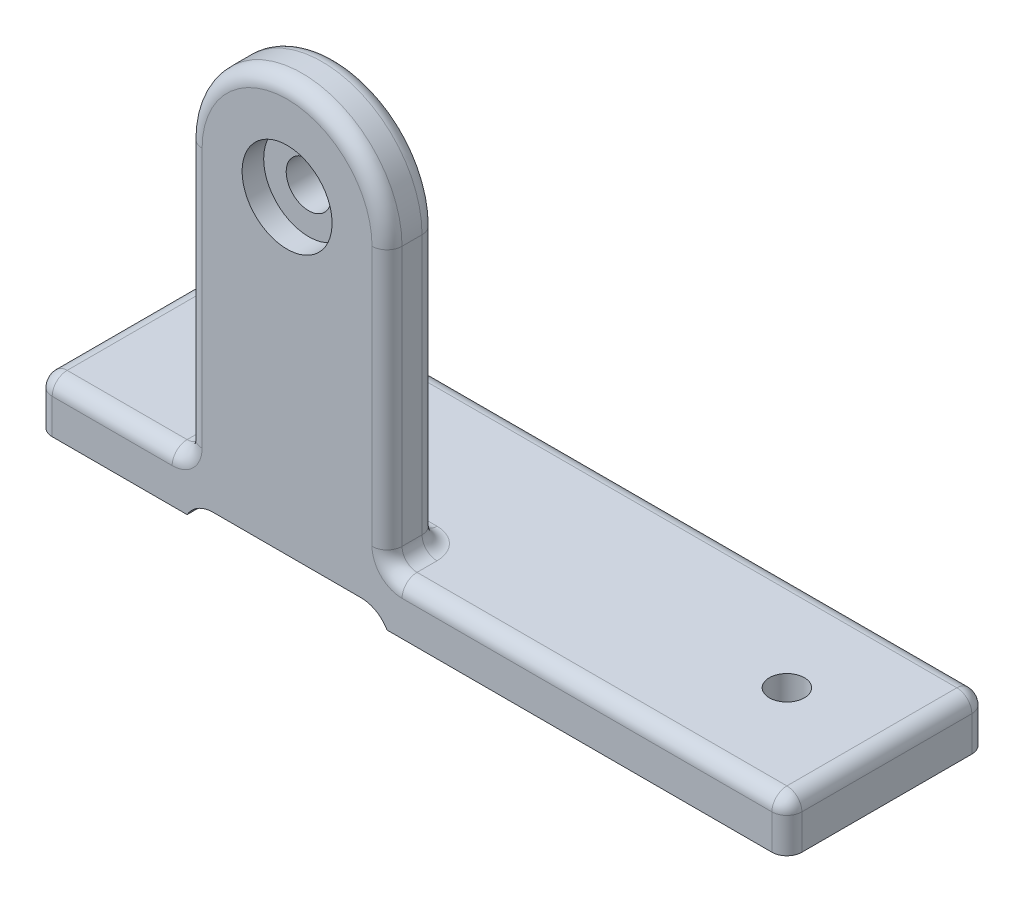
from build123d import *

# Parameters (mm, degrees)
SKETCH1_W           = 150
SKETCH1_H           = 40
BOSS_EXTRUDE1_DEPTH = 10
BOSS_EXTRUDE2_DEPTH = 10
CUT_EXTRUDE1_DEPTH  = 121.208152802
SKETCH8_R           = 3.5
CUT_EXTRUDE2_DEPTH  = 108.935165725
FILLET1_R           = 3


with BuildPart() as part:
    # Sketch1 → Boss-Extrude1 (new body)
    with BuildSketch(Plane(origin=(0, 0, 0), x_dir=(1, 0, 0), z_dir=(0, 1, 0))):
        Rectangle(SKETCH1_W, SKETCH1_H)
    extrude(amount=BOSS_EXTRUDE1_DEPTH)

    # Sketch2 → Boss-Extrude2 (add)
    with BuildSketch(Plane.XY.offset(20)):
        with BuildLine():
            Line((-45, 10), (-5, 10))
            Line((-5, 10), (-5, 65))
            ThreePointArc((-5, 65), (-25, 85), (-45, 65))
            Line((-45, 65), (-45, 10))
        make_face()
    extrude(amount=-BOSS_EXTRUDE2_DEPTH)

    # Sketch6 → CBORE for M6 SBHCS1 (revolve, cut)
    with BuildSketch(Plane(origin=(-25, 65, 10), x_dir=(0, 1, 0), z_dir=(1, 0, 0))):
        Polygon((0, 0), (0, 10), (9.005, 10), (9.005, 5.68), (4.5, 5.68), (4.5, 0), align=None)
    revolve(axis=Axis((-25, 65, 3.65), (0, 0, 1)), mode=Mode.SUBTRACT)

    # Sketch7 → Cut-Extrude1 (cut, through all)
    with BuildSketch(Plane.XY.offset(20)):
        with BuildLine():
            Line((-39.803847577, 3), (-10.196152423, 3))
            ThreePointArc((-10.196152423, 3), (-7.196152423, 2.196152423), (-5, 0))
            Line((-5, 0), (-45, 0))
            ThreePointArc((-45, 0), (-42.803847577, 2.196152423), (-39.803847577, 3))
        make_face()
    extrude(amount=-CUT_EXTRUDE1_DEPTH, mode=Mode.SUBTRACT)

    # Sketch8 → Cut-Extrude2 (cut, through all)
    with BuildSketch(Plane(origin=(0, 10, 0), x_dir=(1, 0, 0), z_dir=(0, 1, 0))):
        with Locations(Location((-55, 0, 0), (0, 0, 270))):
            Circle(SKETCH8_R)
        with Locations(Location((55, 0, 0), (0, 0, 270))):
            Circle(SKETCH8_R)
    extrude(amount=-CUT_EXTRUDE2_DEPTH, mode=Mode.SUBTRACT)

    # Fillet1
    fillet1_edges = [part.edges().sort_by_distance(p)[0] for p in [
        (-75, 10, 0),
        (35, 10, 20),
        (-45, 37.5, 10),
        (-45, 10, 15),
        (-25, 85, 10),
        (-5, 37.5, 10),
        (-60, 10, 20),
        (-25, 10, 10),
        (-5, 10, 15),
        (-45, 37.5, 20),
        (-5, 37.5, 20),
        (-25, 85, 20),
        (75, 10, 0),
        (75, 5, 20),
        (-75, 5, 20),
        (-75, 5, -20),
        (75, 5, -20),
        (0, 10, -20),
    ]]
    fillet(fillet1_edges, radius=FILLET1_R)


solid = part.part
